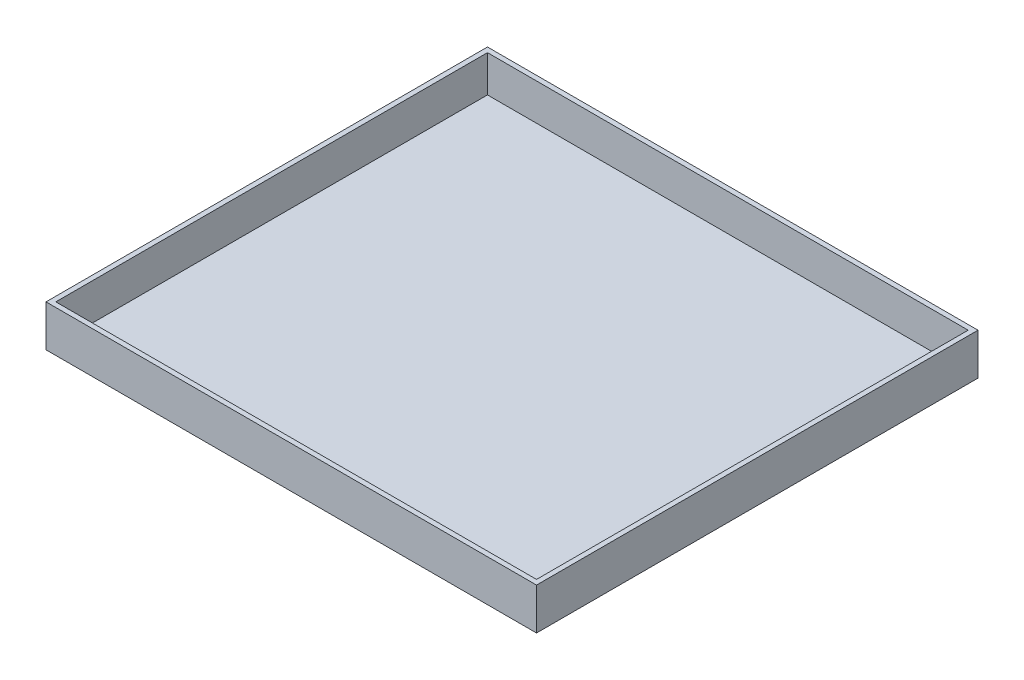
from build123d import *

# Parameters (mm, degrees)
CROQUIS1_W              = 300
CROQUIS1_H              = 270
SALIENTE_EXTRUIR1_DEPTH = 25.4
VACIADO1_T              = -3


with BuildPart() as part:
    # Croquis1 → Saliente-Extruir1 (new body)
    with BuildSketch(Plane(origin=(0, 0, 0), x_dir=(1, 0, 0), z_dir=(0, 1, 0))):
        Rectangle(CROQUIS1_W, CROQUIS1_H)
    extrude(amount=SALIENTE_EXTRUIR1_DEPTH)

    # Vaciado1
    vaciado1_openings = [part.faces().sort_by_distance(p)[0] for p in [
        (0, 25.4, 0),
    ]]
    offset(amount=VACIADO1_T, openings=vaciado1_openings, kind=Kind.INTERSECTION)


solid = part.part
